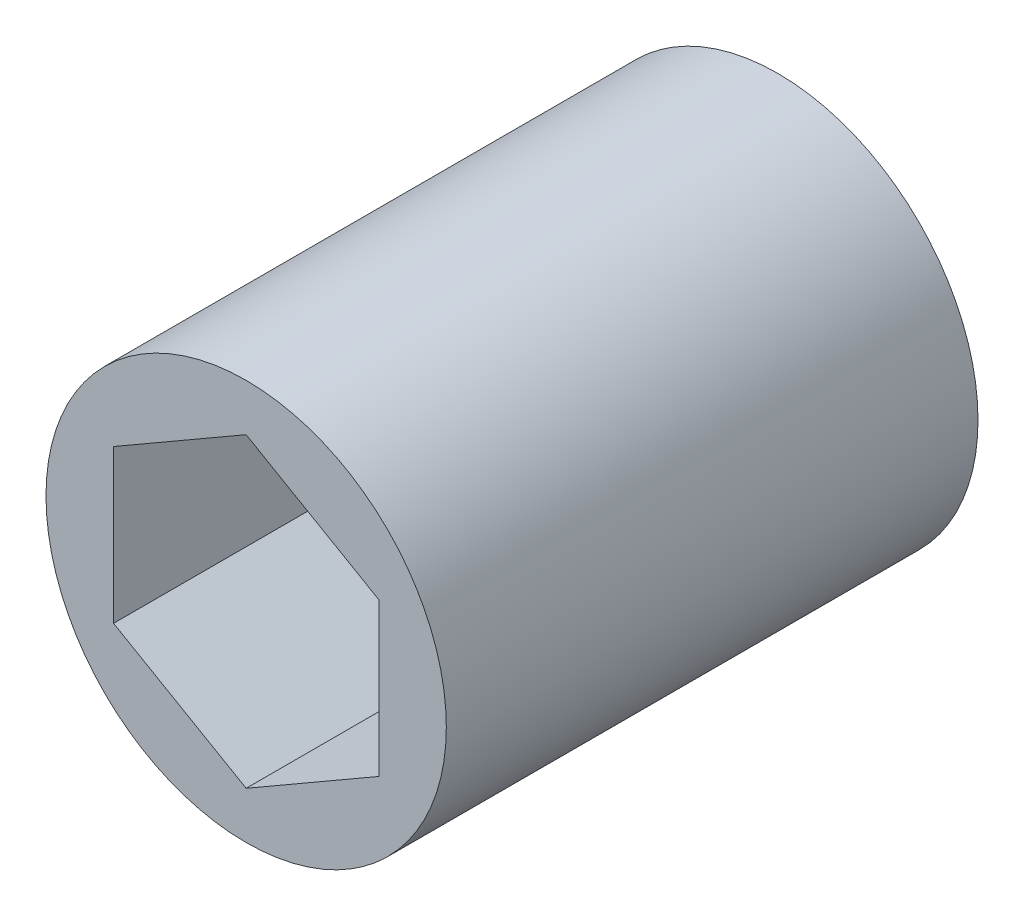
from build123d import *

# Parameters (mm, degrees)
SKETCH1_R           = 10.16
BOSS_EXTRUDE1_DEPTH = 26.9875


with BuildPart() as part:
    # Sketch1 → Boss-Extrude1 (new body)
    with BuildSketch(Plane.XY):
        Circle(SKETCH1_R)
        Polygon((6.731, 3.886144662), (0, 7.772289324), (-6.731, 3.886144662), (-6.731, -3.886144662), (0, -7.772289324), (6.731, -3.886144662), align=None, mode=Mode.SUBTRACT)
    extrude(amount=BOSS_EXTRUDE1_DEPTH)


solid = part.part
